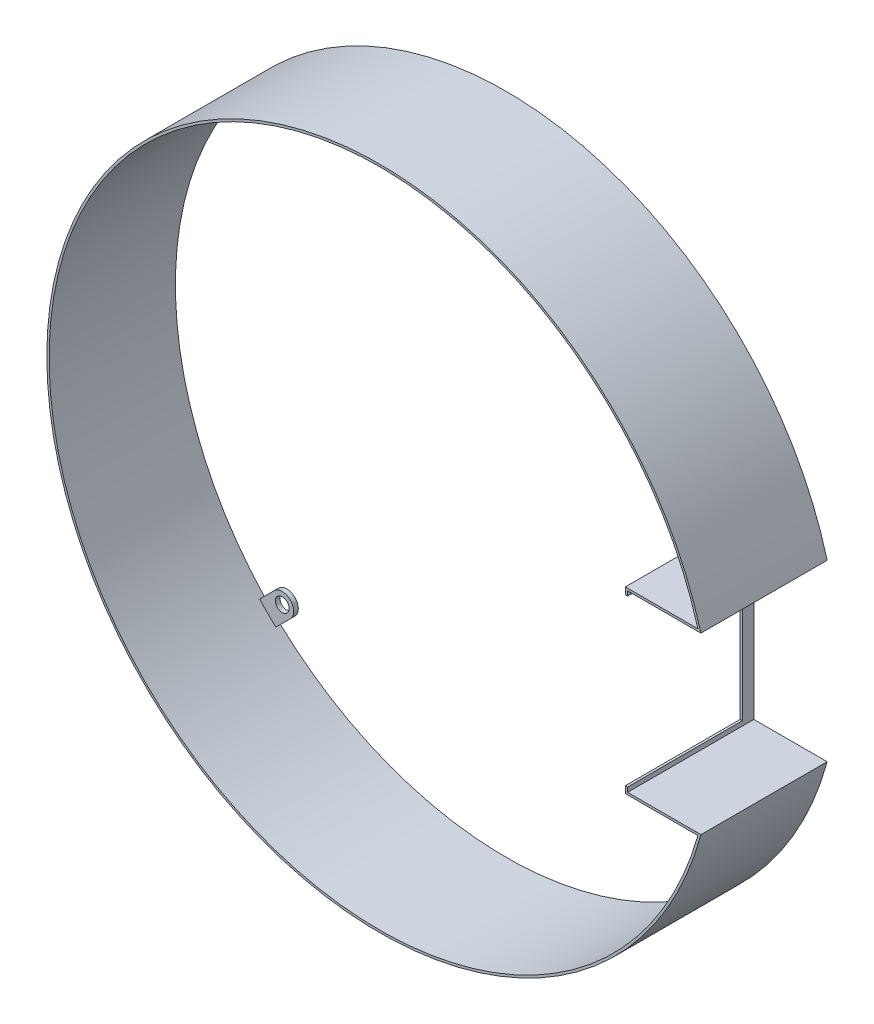
from build123d import *

# Parameters (mm, degrees)
COVER_BASE_DEPTH       = 27.5
SKIZZE2_W              = 25
SKIZZE2_H              = 18
CAMERA_COVER_CUT_DEPTH = 148.947625868
SKIZZE3_R              = 1.5
SPACER_SCREW_DEPTH     = 1
KREISMUSTER1_COUNT     = 4


with BuildPart() as part:
    # Skizze1 → Cover Base (new body)
    with BuildSketch(Plane.XY):
        with BuildLine():
            Line((69.309090313, 19.5), (53.5, 19.5))
            Line((53.5, 19.5), (53.5, 0))
            Line((53.5, 0), (54, 0))
            Line((54, 0), (54, 19))
            Line((54, 19), (69.966063202, 19))
            ThreePointArc((69.966063202, 19), (-9.584112318, 71.863723749), (-72.5, 0))
            Line((-72.5, 0), (-72, 0))
            ThreePointArc((-72, 0), (-9.842395478, 71.324100073), (69.309090313, 19.5))
        make_face()
    cover_base = extrude(amount=COVER_BASE_DEPTH)

    # Skizze2 → Camera Cover Cut (cut, through all)
    with BuildSketch(Plane(origin=(53.5, 0, 0), x_dir=(0, 0, -1), z_dir=(1, 0, 0))):
        with Locations((-15, 9)):
            Rectangle(SKIZZE2_W, SKIZZE2_H)
    camera_cover_cut = extrude(amount=CAMERA_COVER_CUT_DEPTH, mode=Mode.SUBTRACT)

    # Cover Mirror: Cover Base, Camera Cover Cut across plane
    add(cover_base.mirror(Plane.ZX))
    add(camera_cover_cut.mirror(Plane.ZX), mode=Mode.SUBTRACT)

    # Skizze3 → Spacer Screw (add)
    with BuildSketch(Plane.XY):
        with BuildLine():
            ThreePointArc((52.648755544, 49.113221638), (50.911688245, 50.911688245), (49.113221638, 52.648755544))
            Line((49.113221638, 52.648755544), (45.961940777, 49.497474683))
            ThreePointArc((45.961940777, 49.497474683), (45.961940777, 45.961940777), (49.497474683, 45.961940777))
            Line((49.497474683, 45.961940777), (52.648755544, 49.113221638))
        make_face()
        with Locations((47.72970773, 47.72970773)):
            Circle(SKIZZE3_R, mode=Mode.SUBTRACT)
    spacer_screw = extrude(amount=SPACER_SCREW_DEPTH)

    # Kreismuster1: Spacer Screw ×4 about axis
    kreismuster1_axis = Axis((0, 0, 0), (0, 0, 1))
    for i in range(1, KREISMUSTER1_COUNT):
        add(spacer_screw.rotate(kreismuster1_axis, i * 360 / KREISMUSTER1_COUNT))


solid = part.part
